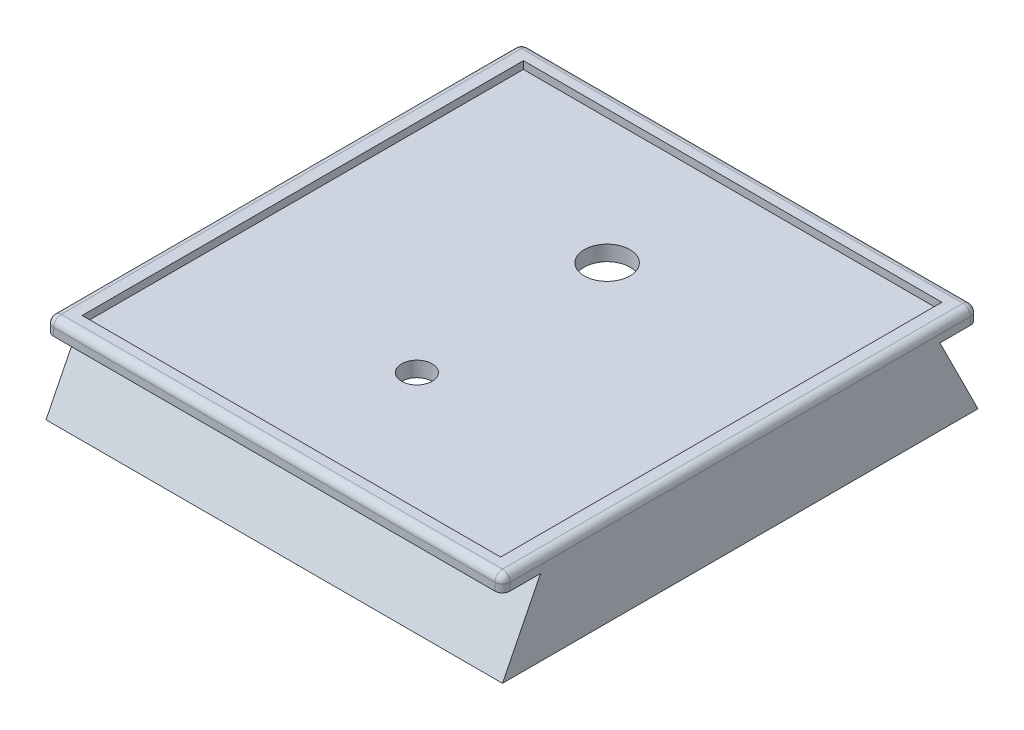
from build123d import *

# Parameters (mm, degrees)
SKETCH1_W           = 60
SKETCH1_H           = 62.5
BOSS_EXTRUDE1_DEPTH = 10
CUT_EXTRUDE1_DEPTH  = 69.385396833
CUT_EXTRUDE2_DEPTH  = 69.385396833
SKETCH4_W           = 60
SKETCH4_H           = 62.5
BOSS_EXTRUDE2_DEPTH = 2
FILLET1_R           = 1
FILLET2_R           = 1
SKETCH5_W           = 55
SKETCH5_H           = 58
CUT_EXTRUDE3_DEPTH  = 1
SKETCH6_W           = 50
SKETCH6_H           = 50
CUT_EXTRUDE4_DEPTH  = 9
SKETCH7_R           = 3
CUT_EXTRUDE5_DEPTH  = 9
SKETCH8_R           = 2
CUT_EXTRUDE6_DEPTH  = 10


with BuildPart() as part:
    # Sketch1 → Boss-Extrude1 (new body)
    with BuildSketch(Plane(origin=(0, 0, 0), x_dir=(1, 0, 0), z_dir=(0, 1, 0))):
        Rectangle(SKETCH1_W, SKETCH1_H)
    extrude(amount=BOSS_EXTRUDE1_DEPTH)

    # Sketch2 → Cut-Extrude1 (cut, through all)
    with BuildSketch(Plane(origin=(30, 0, 0), x_dir=(0, 0, -1), z_dir=(1, 0, 0))):
        Polygon((31.25, 0), (26.25, 10), (31.25, 10), align=None)
    extrude(amount=-CUT_EXTRUDE1_DEPTH, mode=Mode.SUBTRACT)

    # Sketch3 → Cut-Extrude2 (cut, through all)
    with BuildSketch(Plane(origin=(30, 0, 0), x_dir=(0, 0, -1), z_dir=(1, 0, 0))):
        Polygon((-31.25, 0), (-26.25, 10), (-31.25, 10), align=None)
    extrude(amount=-CUT_EXTRUDE2_DEPTH, mode=Mode.SUBTRACT)

    # Sketch4 → Boss-Extrude2 (add)
    with BuildSketch(Plane(origin=(0, 10, 0), x_dir=(1, 0, 0), z_dir=(0, 1, 0))):
        Rectangle(SKETCH4_W, SKETCH4_H)
    extrude(amount=BOSS_EXTRUDE2_DEPTH)

    # Fillet1
    fillet1_edges = [part.edges().sort_by_distance(p)[0] for p in [
        (-30, 11, 31.25),
        (30, 11, 31.25),
        (30, 11, -31.25),
        (-30, 11, -31.25),
    ]]
    fillet(fillet1_edges, radius=FILLET1_R)

    # Fillet2
    fillet2_edges = [part.edges().sort_by_distance(p)[0] for p in [
        (0, 12, -31.25),
        (30, 12, 0),
        (0, 12, 31.25),
        (-30, 12, 0),
        (29.707106781, 12, 30.957106781),
        (-29.707106781, 12, 30.957106781),
        (-29.707106781, 12, -30.957106781),
        (29.707106781, 12, -30.957106781),
    ]]
    fillet(fillet2_edges, radius=FILLET2_R)

    # Sketch5 → Cut-Extrude3 (cut)
    with BuildSketch(Plane(origin=(0, 12, 0), x_dir=(1, 0, 0), z_dir=(0, 1, 0))):
        Rectangle(SKETCH5_W, SKETCH5_H)
    extrude(amount=-CUT_EXTRUDE3_DEPTH, mode=Mode.SUBTRACT)

    # Sketch6 → Cut-Extrude4 (cut)
    with BuildSketch(Plane.XZ):
        Rectangle(SKETCH6_W, SKETCH6_H)
    extrude(amount=-CUT_EXTRUDE4_DEPTH, mode=Mode.SUBTRACT)

    # Sketch7 → Cut-Extrude5 (cut)
    with BuildSketch(Plane.XZ.offset(-9)):
        with Locations(Location((0, -12.5, 0), (0, 0, 270))):
            Circle(SKETCH7_R)
    extrude(amount=-CUT_EXTRUDE5_DEPTH, mode=Mode.SUBTRACT)

    # Sketch8 → Cut-Extrude6 (cut)
    with BuildSketch(Plane(origin=(0, 11, 0), x_dir=(1, 0, 0), z_dir=(0, 1, 0))):
        with Locations(Location((0, -12.5, 0), (0, 0, 270))):
            Circle(SKETCH8_R)
    extrude(amount=-CUT_EXTRUDE6_DEPTH, mode=Mode.SUBTRACT)


solid = part.part
